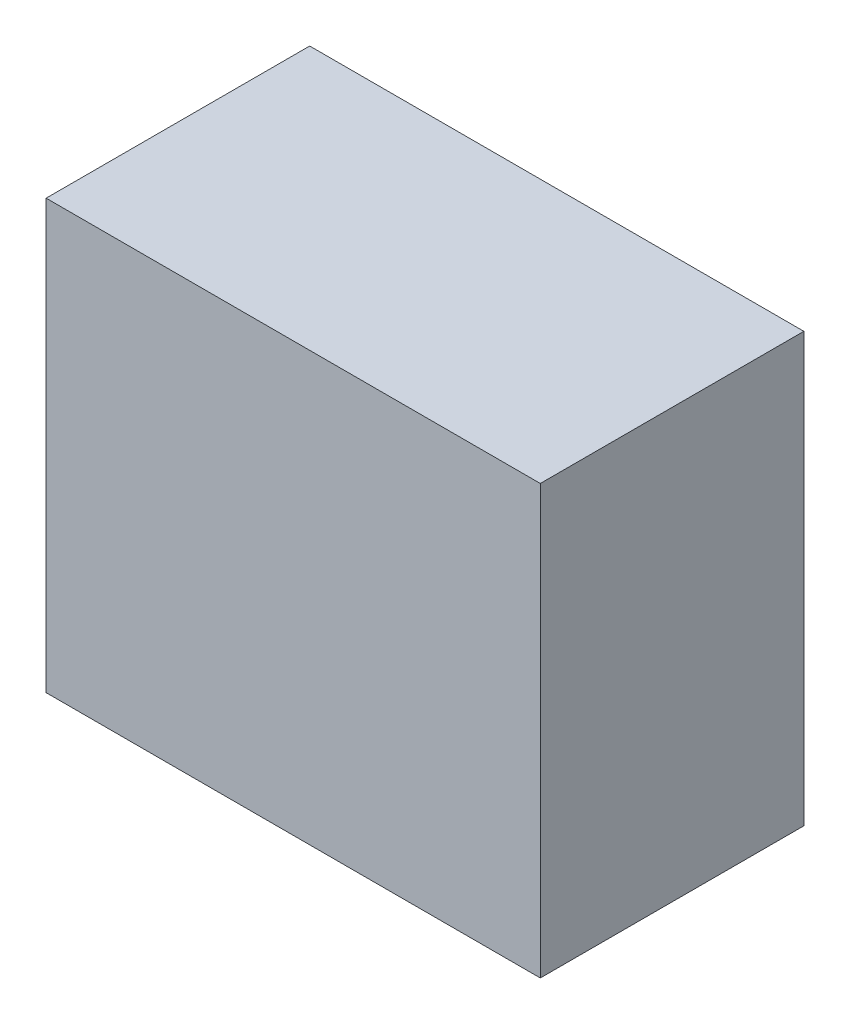
from build123d import *

# Parameters (mm, degrees)
SKETCH1_W           = 381
SKETCH1_H           = 330.2
BOSS_EXTRUDE1_DEPTH = 203.2


with BuildPart() as part:
    # Sketch1 → Boss-Extrude1 (new body)
    with BuildSketch(Plane.XY):
        with Locations((-672.671326192, -144.630519006)):
            Rectangle(SKETCH1_W, SKETCH1_H)
    extrude(amount=BOSS_EXTRUDE1_DEPTH)


solid = part.part
